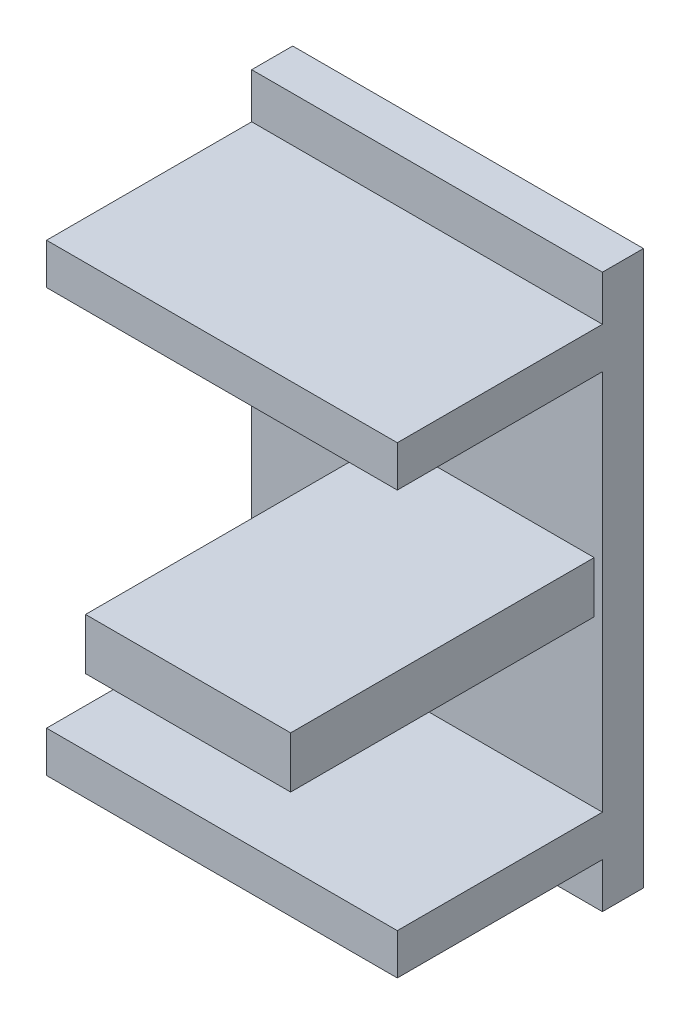
from build123d import *

# Parameters (mm, degrees)
SKETCH1_W           = 68.58
SKETCH1_H           = 43.434
BOSS_EXTRUDE1_DEPTH = 5.08
SKETCH2_W           = 43.434
SKETCH2_H           = 5.08
BOSS_EXTRUDE2_DEPTH = 25.4
SKETCH3_W           = 25.4
SKETCH3_H           = 6.35
BOSS_EXTRUDE3_DEPTH = 37.592


with BuildPart() as part:
    # Sketch1 → Boss-Extrude1 (new body)
    with BuildSketch(Plane(origin=(0, 0, 0), x_dir=(0, 1, 0), z_dir=(0, 0, 1))):
        with Locations((34.29, 21.717)):
            Rectangle(SKETCH1_W, SKETCH1_H)
    extrude(amount=BOSS_EXTRUDE1_DEPTH)

    # Sketch2 → Boss-Extrude2 (add)
    with BuildSketch(Plane.XY.offset(5.08)):
        with Locations((-21.717, 8.128)):
            Rectangle(SKETCH2_W, SKETCH2_H)
        with Locations((-21.717, 60.452)):
            Rectangle(SKETCH2_W, SKETCH2_H)
    extrude(amount=BOSS_EXTRUDE2_DEPTH)

    # Sketch3 → Boss-Extrude3 (add)
    with BuildSketch(Plane.XY.offset(5.08)):
        with Locations((-13.716, 34.29)):
            Rectangle(SKETCH3_W, SKETCH3_H)
    extrude(amount=BOSS_EXTRUDE3_DEPTH)


solid = part.part
